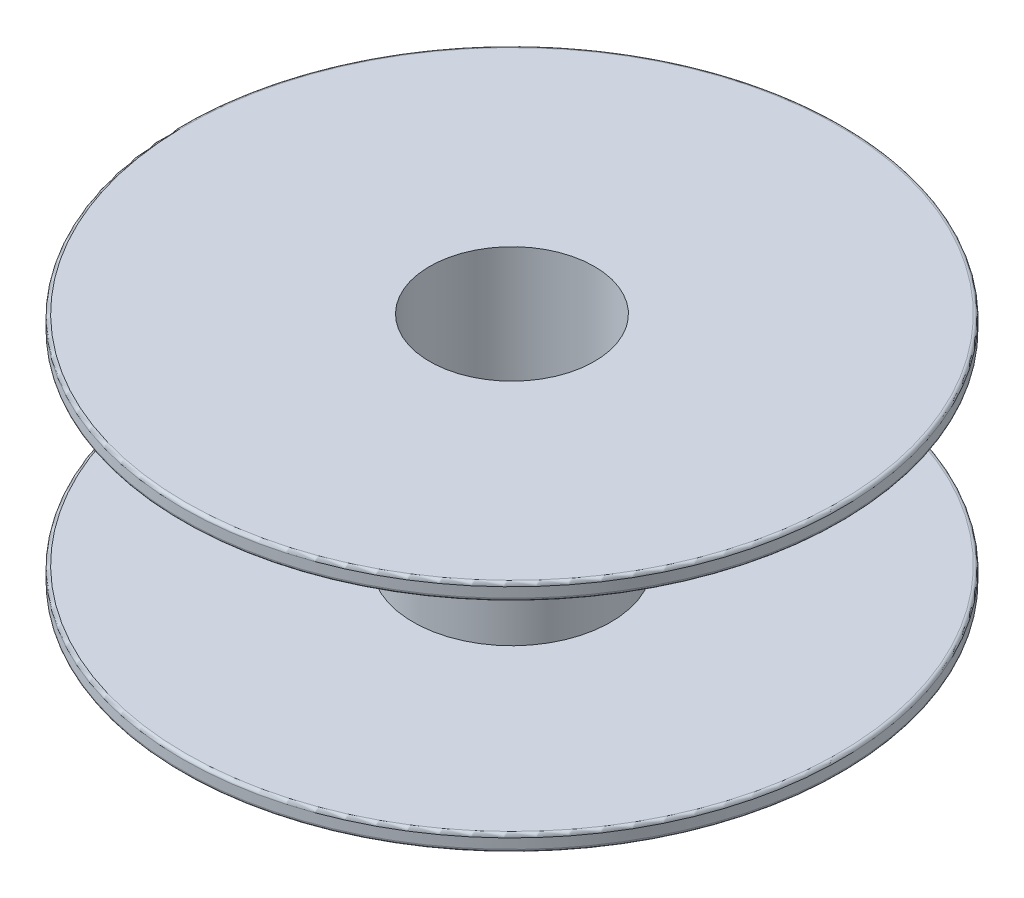
from build123d import *

# Parameters (mm, degrees)
FILLET1_R = 1


with BuildPart() as part:
    # Sketch1 → Revolve1 (revolve)
    with BuildSketch(Plane(origin=(0, 0, 0), x_dir=(0, 0, -1), z_dir=(1, 0, 0))):
        Polygon((25, 0), (100, 0), (100, 5), (30, 5), (30, 66), (100, 66), (100, 71), (25, 71), align=None)
    revolve(axis=Axis((0, 0, 0), (0, 1, 0)))

    # Fillet1
    fillet1_edges = [part.edges().sort_by_distance(p)[0] for p in [
        (0, 71, 100),
        (0, 66, 100),
        (0, 5, 100),
        (0, 0, 100),
    ]]
    fillet(fillet1_edges, radius=FILLET1_R)


solid = part.part
